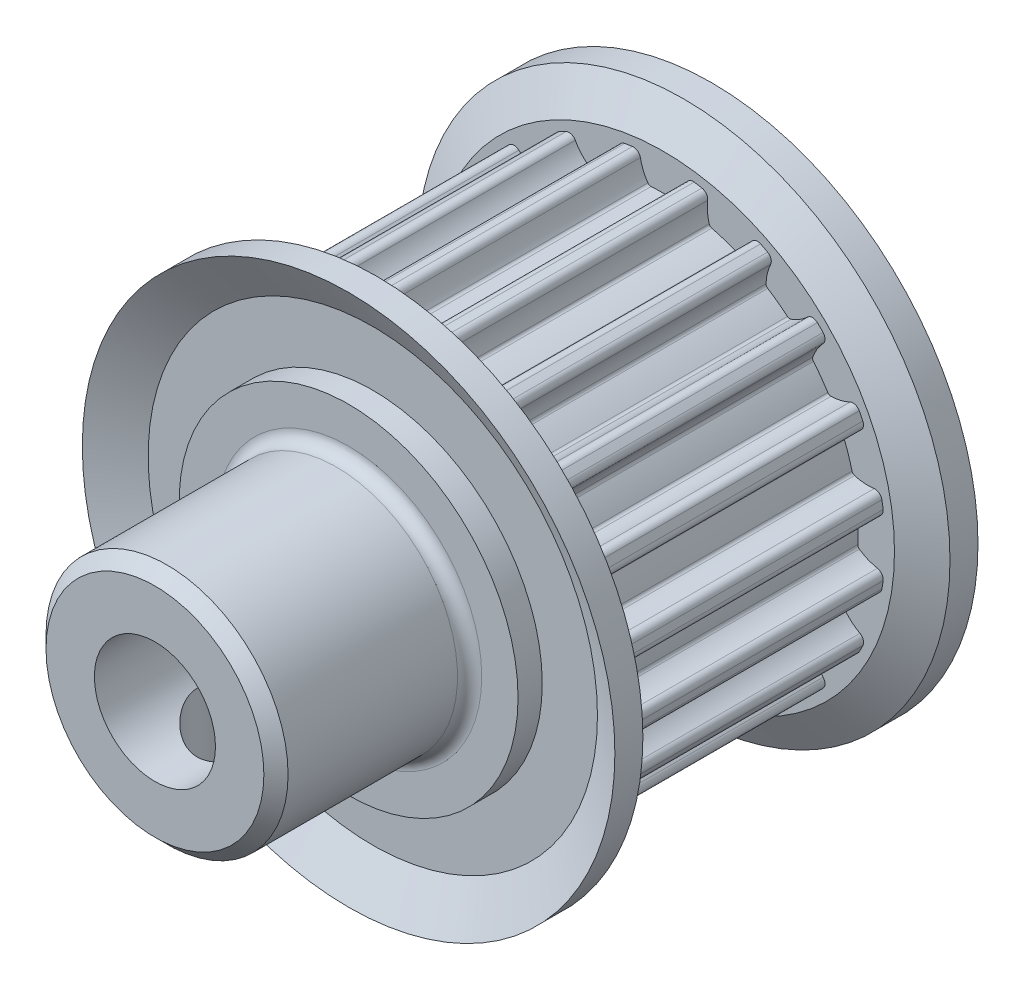
from build123d import *

# Parameters (mm, degrees)
EXTRUDE_1_DEPTH          = 5.5
PATTERN_CIRCULAR_1_COUNT = 20
CUT_EXTRUDE_1_DEPTH      = 18.269916039
CUT_EXTRUDE_1_DEPTH_BACK = 18.269916039
SKETCH_6_R               = 2.5
CHAMFER_1_SIZE           = 0.25
EXTRUDE_START            = 8
SKETCH_27_R              = 5
SKETCH_27_R_2            = 2.5
EXTRUDE_2_DEPTH          = 8
FILLET_1_R               = 0.5
SKETCH_28_R              = 1.75
CUT_EXTRUDE_10_DEPTH     = 22.960191256
CHAMFER_10_SIZE          = 0.5


with BuildPart() as part:
    # 草图3 → 旋转1 (revolve)
    with BuildSketch(Plane(origin=(0, 0, 0), x_dir=(0, 0, -1), z_dir=(1, 0, 0))):
        Polygon((7.5, 0), (7.5, 7), (6.5, 7), (6.5, 9.2803762), (7.5, 11), (6.343207683, 11), (5.5, 9.55), (5.5, 8.05), (-5.5, 8.05), (-5.5, 9.55), (-6.343207683, 11), (-7.5, 11), (-6.5, 9.2803762), (-6.5, 7), (-7.5, 7), (-7.5, 0), align=None)
    revolve(axis=Axis((0, 0, 7.5), (0, 0, -1)))

    # 草图4 → 凸台-拉伸1 (add, symmetric)
    with BuildSketch(Plane.XY):
        with BuildLine():
            ThreePointArc((-1.273291514, 9.081168907), (-1.434504044, 9.057102083), (-1.595263329, 9.030173581))
            ThreePointArc((-1.595263329, 9.030173581), (-1.778416103, 8.916437801), (-1.832460253, 8.707727485))
            ThreePointArc((-1.832460253, 8.707727485), (-1.822622708, 8.300426591), (-1.896567814, 7.899773478))
            ThreePointArc((-1.896567814, 7.899773478), (-1.936253207, 7.834195194), (-2.003155883, 7.796785652))
            ThreePointArc((-2.003155883, 7.796785652), (-1.259297444, 7.950891142), (-0.504224813, 8.034193011))
            ThreePointArc((-0.504224813, 8.034193011), (-0.579413222, 8.049097536), (-0.637421079, 8.099202729))
            ThreePointArc((-0.637421079, 8.099202729), (-0.831555674, 8.457396188), (-0.948062511, 8.847802326))
            ThreePointArc((-0.948062511, 8.847802326), (-1.063956587, 9.029597071), (-1.273291514, 9.081168907))
        make_face()
    extrude_1 = extrude(amount=EXTRUDE_1_DEPTH, both=True)

    # 阵列(圆周)1: 凸台-拉伸1 ×20 about axis
    pattern_circular_1_axis = Axis((0, 0, 7.5), (0, 0, 1))
    for i in range(1, PATTERN_CIRCULAR_1_COUNT):
        add(extrude_1.rotate(pattern_circular_1_axis, i * 360 / PATTERN_CIRCULAR_1_COUNT))

    # 草图6 → 切除-拉伸1 (cut, two sides: drawn at the far end of the back side and taken through both)
    with BuildSketch(Plane.XY.offset(-CUT_EXTRUDE_1_DEPTH_BACK)):
        Circle(SKETCH_6_R)
    extrude(amount=CUT_EXTRUDE_1_DEPTH + CUT_EXTRUDE_1_DEPTH_BACK, mode=Mode.SUBTRACT)

    # 倒角1
    chamfer_1_edges = [part.edges().sort_by_distance(p)[0] for p in [
        (-2.5, 0, -7.5),
        (-2.5, 0, 7.5),
    ]]
    chamfer(chamfer_1_edges, length=CHAMFER_1_SIZE)

    # 草图27 → 凸台-拉伸2 (add)
    with BuildSketch(Plane.XY.offset(7.5).offset(EXTRUDE_START)):
        Circle(SKETCH_27_R)
        Circle(SKETCH_27_R_2, mode=Mode.SUBTRACT)
    extrude(amount=-EXTRUDE_2_DEPTH)

    # 圆角1
    fillet_1_edges = [part.edges().sort_by_distance(p)[0] for p in [
        (-5, 0, 7.5),
    ]]
    fillet(fillet_1_edges, radius=FILLET_1_R)

    # 草图28 → 切除-拉伸10 (cut, through all)
    with BuildSketch(Plane(origin=(0, 0, 0), x_dir=(1, 0, 0), z_dir=(0, 1, 0))):
        with Locations((0, -12)):
            Circle(SKETCH_28_R)
    extrude(amount=-CUT_EXTRUDE_10_DEPTH, mode=Mode.SUBTRACT)

    # 倒角10
    chamfer_10_edges = [part.edges().sort_by_distance(p)[0] for p in [
        (-5, 0, 15.5),
    ]]
    chamfer(chamfer_10_edges, length=CHAMFER_10_SIZE)


solid = part.part
